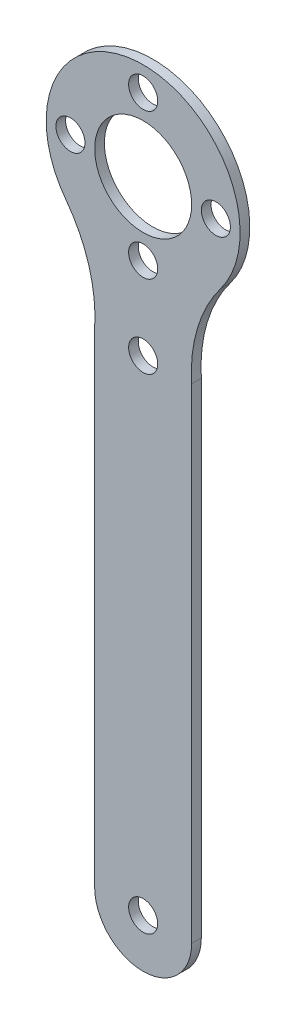
from build123d import *

# Parameters (mm, degrees)
SKETCH_1_R      = 1.5
SKETCH_1_R_2    = 5
EXTRUDE_1_DEPTH = 1


with BuildPart() as part:
    # 草图1 → 凸台-拉伸1 (new body)
    with BuildSketch(Plane.XY):
        with BuildLine():
            Line((-5, 25), (-5, -25))
            ThreePointArc((-5, -25), (0, -30), (5, -25))
            Line((5, -25), (5, 25))
            ThreePointArc((5, 25), (5.598988732, 30.259631636), (7.987721006, 34.983662814))
            ThreePointArc((7.987721006, 34.983662814), (0, 51), (-7.987721006, 34.983662814))
            ThreePointArc((-7.987721006, 34.983662814), (-5.598988732, 30.259631636), (-5, 25))
        make_face()
        with Locations((0, -25)):
            Circle(SKETCH_1_R, mode=Mode.SUBTRACT)
        with Locations((0, 25)):
            Circle(SKETCH_1_R, mode=Mode.SUBTRACT)
        with Locations((7.5, 41)):
            Circle(SKETCH_1_R, mode=Mode.SUBTRACT)
        with Locations((-7.5, 41)):
            Circle(SKETCH_1_R, mode=Mode.SUBTRACT)
        with Locations((0, 33.5)):
            Circle(SKETCH_1_R, mode=Mode.SUBTRACT)
        with Locations((0, 41)):
            Circle(SKETCH_1_R_2, mode=Mode.SUBTRACT)
        with Locations((0, 48.5)):
            Circle(SKETCH_1_R, mode=Mode.SUBTRACT)
    extrude(amount=EXTRUDE_1_DEPTH)


solid = part.part
